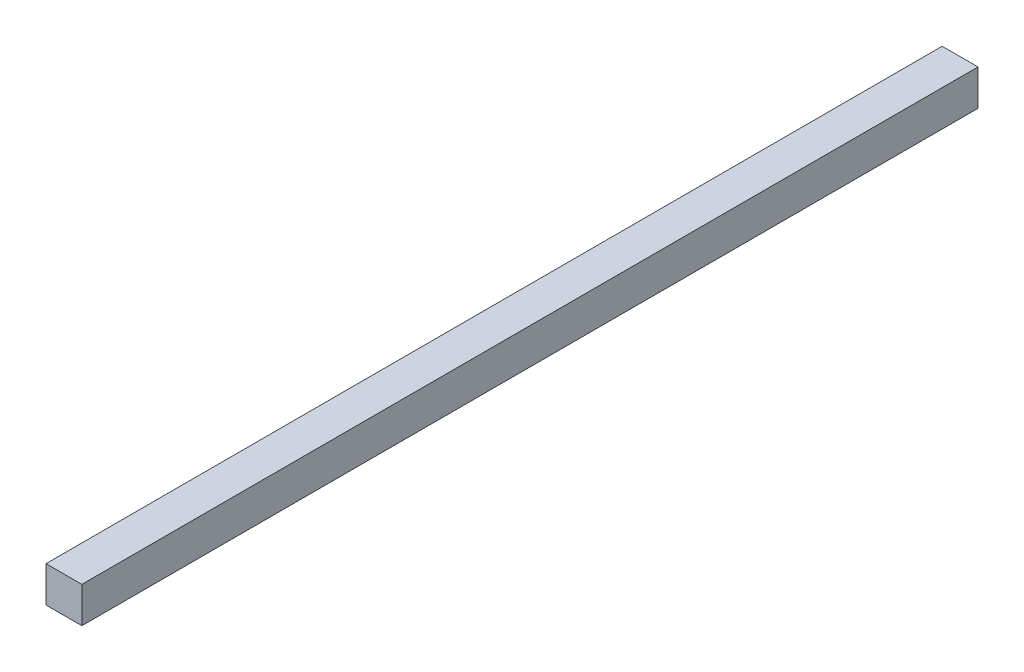
from build123d import *

# Parameters (mm, degrees)
SKETCH_1_W      = 8
SKETCH_1_H      = 8
EXTRUDE_1_DEPTH = 200


with BuildPart() as part:
    # 草图1 → 凸台-拉伸1 (new body)
    with BuildSketch(Plane.XY):
        Rectangle(SKETCH_1_W, SKETCH_1_H)
    extrude(amount=EXTRUDE_1_DEPTH)


solid = part.part
